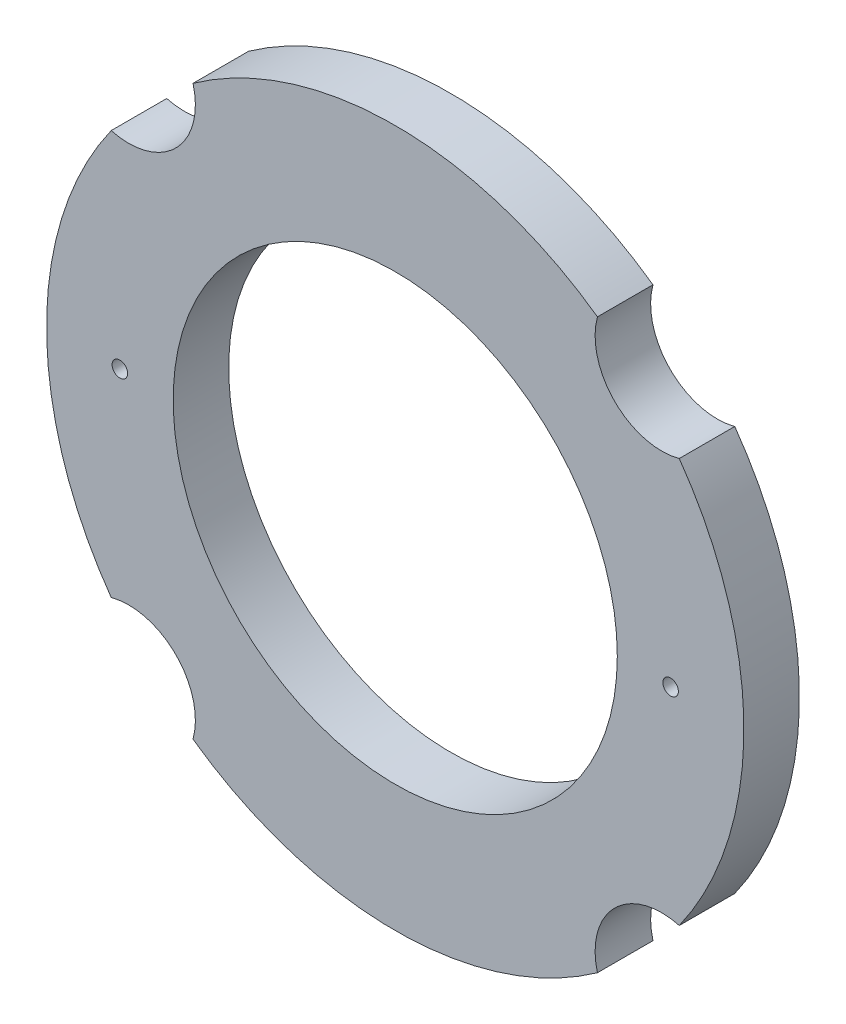
from build123d import *

# Parameters (mm, degrees)
SKETCH_1_R          = 1.75
SKETCH_1_R_2        = 50
EXTRUDE_1_DEPTH     = 12.5
SKETCH_1_3_R        = 5
SKETCH_1_3_R_2      = 1.75
CUT_EXTRUDE_1_DEPTH = 4


with BuildPart() as part:
    # 草图1 → 凸台-拉伸1 (new body)
    with BuildSketch(Plane.XY):
        with BuildLine():
            ThreePointArc((63.94815926, -45.528924074), (78.5, 0), (63.94815926, 45.528924074))
            ThreePointArc((63.94815926, 45.528924074), (49.393398282, 49.393398282), (45.528924074, 63.94815926))
            ThreePointArc((45.528924074, 63.94815926), (0, 78.5), (-45.528924074, 63.94815926))
            ThreePointArc((-45.528924074, 63.94815926), (-49.393398282, 49.393398282), (-63.94815926, 45.528924074))
            ThreePointArc((-63.94815926, 45.528924074), (-78.5, 0), (-63.94815926, -45.528924074))
            ThreePointArc((-63.94815926, -45.528924074), (-49.393398282, -49.393398282), (-45.528924074, -63.94815926))
            ThreePointArc((-45.528924074, -63.94815926), (0, -78.5), (45.528924074, -63.94815926))
            ThreePointArc((45.528924074, -63.94815926), (49.393398282, -49.393398282), (63.94815926, -45.528924074))
        make_face()
        with Locations((-62, 0)):
            Circle(SKETCH_1_R, mode=Mode.SUBTRACT)
        Circle(SKETCH_1_R_2, mode=Mode.SUBTRACT)
        with Locations((62, 0)):
            Circle(SKETCH_1_R, mode=Mode.SUBTRACT)
    extrude(amount=EXTRUDE_1_DEPTH)

    # 草图1<3> → 切除-拉伸1 (cut)
    # profile 1 of 2: a face of its own
    with BuildSketch(Plane.XY):
        with Locations((-62, 0)):
            Circle(SKETCH_1_3_R)
        with Locations((-62, 0)):
            Circle(SKETCH_1_3_R_2, mode=Mode.SUBTRACT)
    # profile 2 of 2: a face of its own
    with BuildSketch(Plane.XY):
        with Locations((62, 0)):
            Circle(SKETCH_1_3_R)
        with Locations((62, 0)):
            Circle(SKETCH_1_3_R_2, mode=Mode.SUBTRACT)
    extrude(amount=CUT_EXTRUDE_1_DEPTH, mode=Mode.SUBTRACT)


solid = part.part
